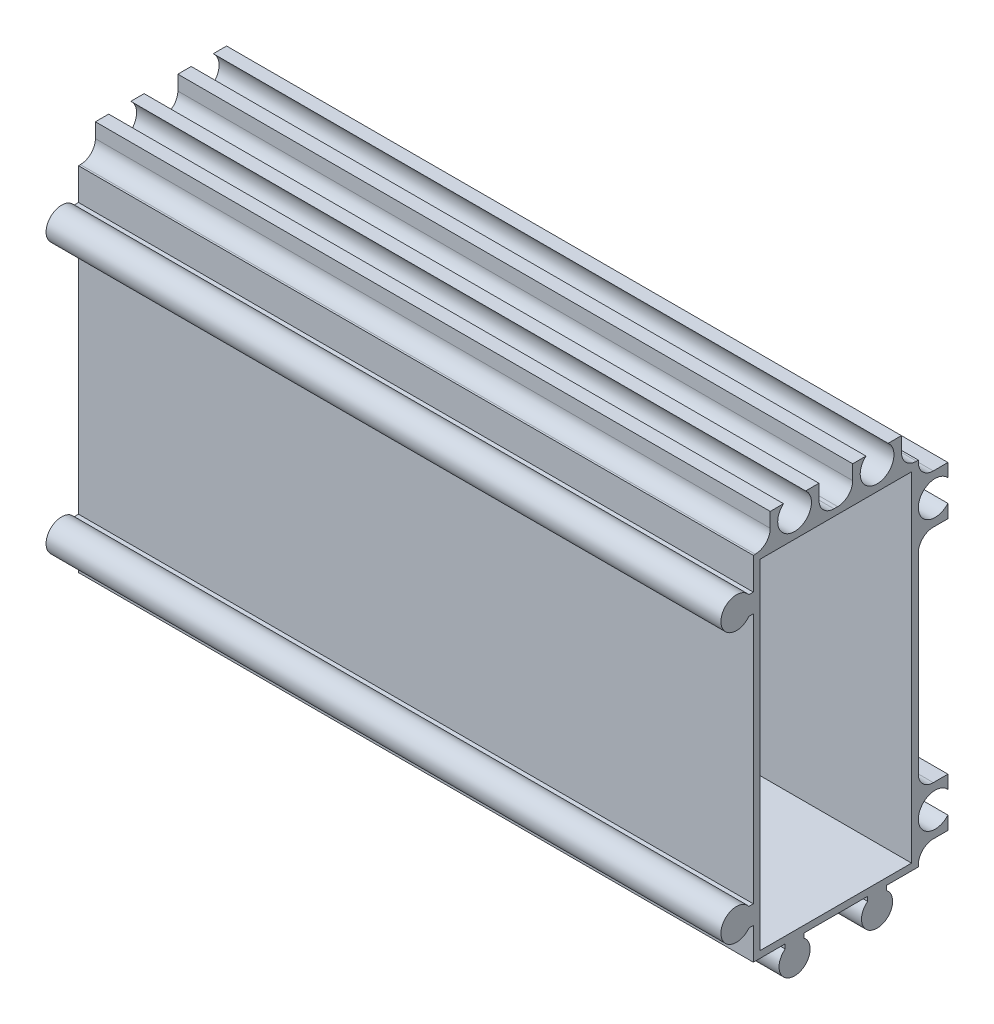
from build123d import *

# Parameters (mm, degrees)
EXTRUDE_1_DEPTH             = 90
SKETCH_2_W                  = 90
SKETCH_2_H                  = 17.75
EXTRUDE_2_DEPTH             = 8.2
SKETCH_3_W                  = 90
SKETCH_3_H                  = 50.95
EXTRUDE_3_DEPTH             = 8.2
SKETCH_4_W                  = 3.95
SKETCH_4_H                  = 29.5
CUT_EXTRUDE_1_DEPTH         = 96.44153315
SKETCH_5_W                  = 3.95
SKETCH_5_H                  = 6.2
CUT_EXTRUDE_2_DEPTH         = 96.44153315
SKETCH_6_W                  = 2.25
SKETCH_6_H                  = 3.95
CUT_EXTRUDE_3_DEPTH         = 96.44153315
SKETCH_7_W                  = 4.5
SKETCH_7_H                  = 3.95
CUT_EXTRUDE_4_DEPTH         = 96.44153315
SKETCH_8_W                  = 2.25
SKETCH_8_H                  = 3.95
CUT_EXTRUDE_5_DEPTH         = 96.44153315
SKETCH_9_W                  = 3.95
SKETCH_9_H                  = 2.25
CUT_EXTRUDE_6_DEPTH         = 96.44153315
SKETCH_10_W                 = 20.2
SKETCH_10_H                 = 45.2
CUT_EXTRUDE_7_DEPTH         = 86
HOLE_WIZARD_2_5_2_5_1_D     = 2.5
HOLE_WIZARD_4_5_4_5_1_D     = 4.5
HOLE_WIZARD_8_3_8_3_1_D     = 8.3
HOLE_WIZARD_8_3_8_3_1_DEPTH = 3.2
FILLET_1_R                  = 2
FILLET_2_R                  = 2
EXTRUDE_START               = -90
SKETCH_17_R                 = 1.25
EXTRUDE_4_DEPTH             = 90
CUT_EXTRUDE_START           = -100
SKETCH_18_R                 = 4.15
CUT_EXTRUDE_8_DEPTH         = 100


with BuildPart() as part:
    # Эскиз1 → Бобышка-Вытянуть1 (new body)
    with BuildSketch(Plane(origin=(90, 0, 0), x_dir=(0, 0, -1), z_dir=(1, 0, 0))):
        with BuildLine():
            Line((6.75, -24.093761792), (6.75, 19.25))
            Line((6.75, 19.25), (-11.593761792, 19.25))
            ThreePointArc((-11.593761792, 19.25), (-15.325, 18), (-11.593761792, 16.75))
            Line((-11.593761792, 16.75), (-11, 16.75))
            Line((-11, 16.75), (-11, -16.75))
            Line((-11, -16.75), (-11.593761792, -16.75))
            ThreePointArc((-11.593761792, -16.75), (-15.325, -18), (-11.593761792, -19.25))
            Line((-11.593761792, -19.25), (-11, -19.25))
            Line((-11, -19.25), (-11, -23.5))
            Line((-11, -23.5), (-6.75, -23.5))
            Line((-6.75, -23.5), (-6.75, -24.093761792))
            ThreePointArc((-6.75, -24.093761792), (-5.5, -27.825), (-4.25, -24.093761792))
            Line((-4.25, -24.093761792), (-4.25, -23.5))
            Line((-4.25, -23.5), (4.25, -23.5))
            Line((4.25, -23.5), (4.25, -24.093761792))
            ThreePointArc((4.25, -24.093761792), (5.5, -27.825), (6.75, -24.093761792))
        make_face()
    extrude(amount=-EXTRUDE_1_DEPTH)

    # Эскиз2 → Бобышка-Вытянуть2 (add)
    with BuildSketch(Plane(origin=(0, 19.25, 0), x_dir=(-1, 0, 0), z_dir=(0, 1, 0))):
        with Locations((-45, 2.125)):
            Rectangle(SKETCH_2_W, SKETCH_2_H)
    extrude(amount=EXTRUDE_2_DEPTH)

    # Эскиз3 → Бобышка-Вытянуть3 (add)
    with BuildSketch(Plane(origin=(0, 0, -6.75), x_dir=(-1, 0, 0), z_dir=(0, 0, -1))):
        with Locations((-45, 1.975)):
            Rectangle(SKETCH_3_W, SKETCH_3_H)
    extrude(amount=EXTRUDE_3_DEPTH)

    # Эскиз4 → Вырез-Вытянуть1 (cut, through all)
    with BuildSketch(Plane.ZY):
        with Locations((-12.975, 0)):
            Rectangle(SKETCH_4_W, SKETCH_4_H)
    extrude(amount=-CUT_EXTRUDE_1_DEPTH, mode=Mode.SUBTRACT)

    # Эскиз5 → Вырез-Вытянуть2 (cut, through all)
    with BuildSketch(Plane.ZY):
        with Locations((-12.975, 24.35)):
            Rectangle(SKETCH_5_W, SKETCH_5_H)
    extrude(amount=-CUT_EXTRUDE_2_DEPTH, mode=Mode.SUBTRACT)

    # Эскиз6 → Вырез-Вытянуть3 (cut, through all)
    with BuildSketch(Plane.ZY):
        with Locations((-9.875, 25.475)):
            Rectangle(SKETCH_6_W, SKETCH_6_H)
    extrude(amount=-CUT_EXTRUDE_3_DEPTH, mode=Mode.SUBTRACT)

    # Эскиз7 → Вырез-Вытянуть4 (cut, through all)
    with BuildSketch(Plane.ZY):
        with Locations((0, 25.475)):
            Rectangle(SKETCH_7_W, SKETCH_7_H)
    extrude(amount=-CUT_EXTRUDE_4_DEPTH, mode=Mode.SUBTRACT)

    # Эскиз8 → Вырез-Вытянуть5 (cut, through all)
    with BuildSketch(Plane.ZY):
        with Locations((9.875, 25.475)):
            Rectangle(SKETCH_8_W, SKETCH_8_H)
    extrude(amount=-CUT_EXTRUDE_5_DEPTH, mode=Mode.SUBTRACT)

    # Эскиз9 → Вырез-Вытянуть6 (cut, through all)
    with BuildSketch(Plane.ZY):
        with Locations((-12.975, -22.375)):
            Rectangle(SKETCH_9_W, SKETCH_9_H)
    extrude(amount=-CUT_EXTRUDE_6_DEPTH, mode=Mode.SUBTRACT)

    # Эскиз10 → Вырез-Вытянуть7 (cut)
    with BuildSketch(Plane(origin=(90, 0, 0), x_dir=(0, 0, -1), z_dir=(1, 0, 0))):
        Rectangle(SKETCH_10_W, SKETCH_10_H)
    extrude(amount=-CUT_EXTRUDE_7_DEPTH, mode=Mode.SUBTRACT)

    # Диаметр отверстия Ø2.5 (2.5)1 (through all)
    with Locations(Plane(origin=(90, 0, 0), x_dir=(0, 0, -1), z_dir=(1, 0, 0))):
        with Locations((5.5, -25.75), (-13.25, -18), (-5.5, -25.75), (-13.25, 18)):
            Hole(HOLE_WIZARD_2_5_2_5_1_D / 2)

    # Диаметр отверстия Ø4.5 (4.5)1 (through all)
    with Locations(Plane.ZY):
        with Locations((-13.25, -18), (-13.25, 18), (-5.5, 25.75), (5.5, 25.75)):
            Hole(HOLE_WIZARD_4_5_4_5_1_D / 2)

    # Диаметр отверстия Ø8.3 (8.3)1
    with Locations(Plane.ZY):
        with Locations((0, 0)):
            Hole(HOLE_WIZARD_8_3_8_3_1_D / 2, depth=HOLE_WIZARD_8_3_8_3_1_DEPTH)

    # Скругление1
    fillet_1_edges = [part.edges().sort_by_distance(p)[0] for p in [
        (45, 23.5, 8.75),
    ]]
    fillet(fillet_1_edges, radius=FILLET_1_R)

    # Скругление2
    fillet_2_edges = [part.edges().sort_by_distance(p)[0] for p in [
        (45, 23.5, -8.75),
        (45, 23.5, 2.25),
        (45, 23.5, -2.25),
        (45, -21.25, -11),
        (4, 0, -10.1),
        (4, -22.6, 0),
        (4, 0, 10.1),
        (4, 22.6, 0),
        (45, 14.75, -11),
        (45, -14.75, -11),
        (45, 21.25, -11),
    ]]
    fillet(fillet_2_edges, radius=FILLET_2_R)

    # Эскиз17 → Бобышка-Вытянуть4 (add)
    with BuildSketch(Plane(origin=(90, 0, 0), x_dir=(0, 0, -1), z_dir=(1, 0, 0)).offset(EXTRUDE_START)):
        with Locations((5.5, -25.75)):
            Circle(SKETCH_17_R)
        with Locations((-5.5, -25.75)):
            Circle(SKETCH_17_R)
        with Locations((-13.25, -18)):
            Circle(SKETCH_17_R)
        with Locations((-13.25, 18)):
            Circle(SKETCH_17_R)
    extrude(amount=EXTRUDE_4_DEPTH)

    # Эскиз18 → Вырез-Вытянуть8 (cut)
    with BuildSketch(Plane.ZY.offset(CUT_EXTRUDE_START)):
        Circle(SKETCH_18_R)
    extrude(amount=CUT_EXTRUDE_8_DEPTH, mode=Mode.SUBTRACT)


solid = part.part
